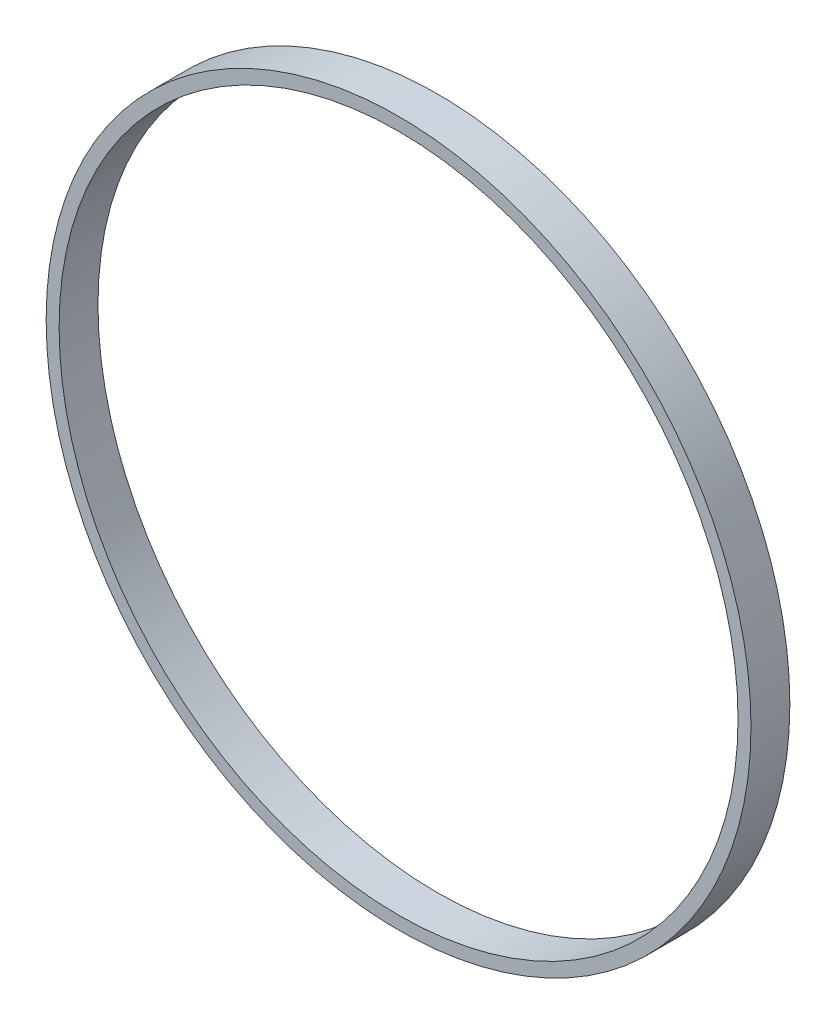
from build123d import *

# Parameters (mm, degrees)
SKETCH2_R           = 86.36
SKETCH2_R_2         = 83.185
BOSS_EXTRUDE1_DEPTH = 9.525


with BuildPart() as part:
    # Sketch2 → Boss-Extrude1 (new body)
    with BuildSketch(Plane.XY):
        with Locations(Location((0, 0, 0), (0, 0, 180))):
            Circle(SKETCH2_R)
        with Locations(Location((0, 0, 0), (0, 0, 180))):
            Circle(SKETCH2_R_2, mode=Mode.SUBTRACT)
    extrude(amount=BOSS_EXTRUDE1_DEPTH)


solid = part.part
